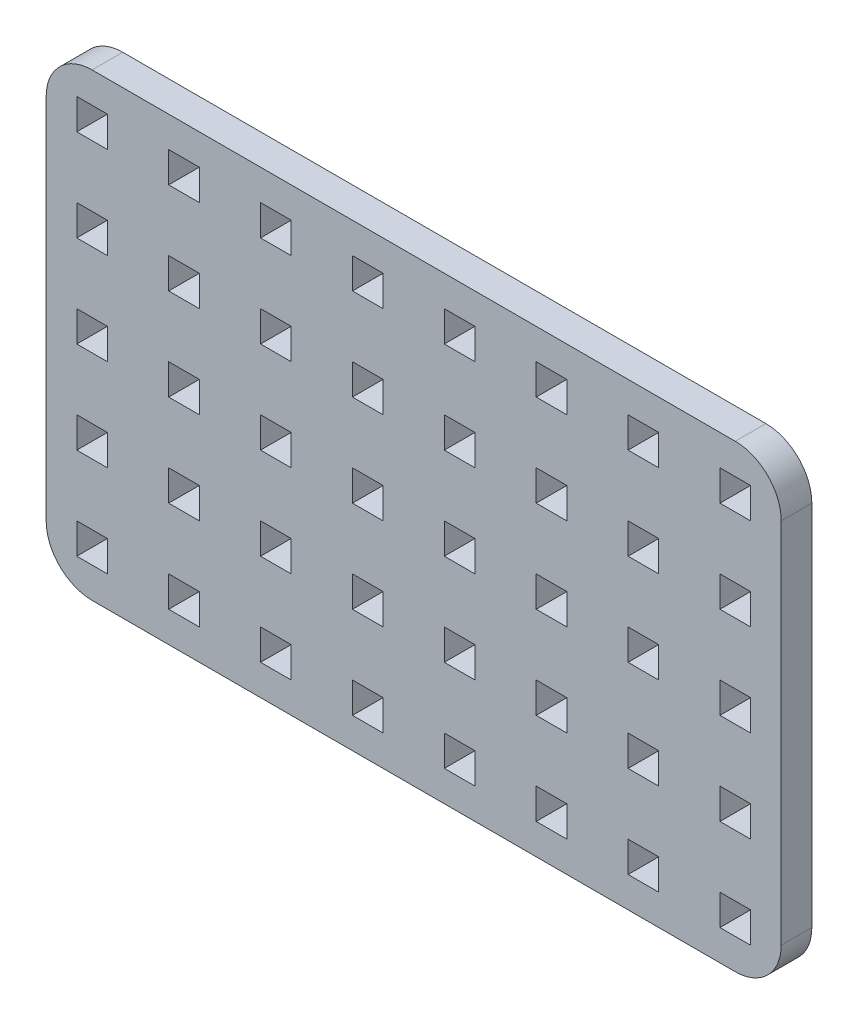
from build123d import *

# Parameters (mm, degrees)
MODEL_W                 = 3
MODEL_H                 = 3
SALIENTE_EXTRUIR1_DEPTH = 3


with BuildPart() as part:
    # Model → Saliente-Extruir1 (new body)
    with BuildSketch(Plane.XY):
        with BuildLine():
            Line((77.4201517, 259.741779533), (77.4201517, 295.741779533))
            ThreePointArc((77.4201517, 295.741779533), (76.102132215, 298.923760049), (72.9201517, 300.241779533))
            Line((72.9201517, 300.241779533), (9.9201517, 300.241779533))
            ThreePointArc((9.9201517, 300.241779533), (6.738171185, 298.923760049), (5.4201517, 295.741779533))
            Line((5.4201517, 295.741779533), (5.4201517, 259.741779533))
            ThreePointArc((5.4201517, 259.741779533), (6.738171185, 256.559799018), (9.9201517, 255.241779533))
            Line((9.9201517, 255.241779533), (72.9201517, 255.241779533))
            ThreePointArc((72.9201517, 255.241779533), (76.102132215, 256.559799018), (77.4201517, 259.741779533))
        make_face()
        with Locations((9.9201517, 295.741779533)):
            Rectangle(MODEL_W, MODEL_H, mode=Mode.SUBTRACT)
        with Locations((18.9201517, 295.741779533)):
            Rectangle(MODEL_W, MODEL_H, mode=Mode.SUBTRACT)
        with Locations((27.9201517, 295.741779533)):
            Rectangle(MODEL_W, MODEL_H, mode=Mode.SUBTRACT)
        with Locations((36.9201517, 295.741779533)):
            Rectangle(MODEL_W, MODEL_H, mode=Mode.SUBTRACT)
        with Locations((45.9201517, 295.741779533)):
            Rectangle(MODEL_W, MODEL_H, mode=Mode.SUBTRACT)
        with Locations((54.9201517, 295.741779533)):
            Rectangle(MODEL_W, MODEL_H, mode=Mode.SUBTRACT)
        with Locations((63.9201517, 295.741779533)):
            Rectangle(MODEL_W, MODEL_H, mode=Mode.SUBTRACT)
        with Locations((72.9201517, 295.741779533)):
            Rectangle(MODEL_W, MODEL_H, mode=Mode.SUBTRACT)
        with Locations((9.9201517, 259.741779533)):
            Rectangle(MODEL_W, MODEL_H, mode=Mode.SUBTRACT)
        with Locations((18.9201517, 259.741779533)):
            Rectangle(MODEL_W, MODEL_H, mode=Mode.SUBTRACT)
        with Locations((27.9201517, 259.741779533)):
            Rectangle(MODEL_W, MODEL_H, mode=Mode.SUBTRACT)
        with Locations((36.9201517, 259.741779533)):
            Rectangle(MODEL_W, MODEL_H, mode=Mode.SUBTRACT)
        with Locations((45.9201517, 259.741779533)):
            Rectangle(MODEL_W, MODEL_H, mode=Mode.SUBTRACT)
        with Locations((54.9201517, 259.741779533)):
            Rectangle(MODEL_W, MODEL_H, mode=Mode.SUBTRACT)
        with Locations((63.9201517, 259.741779533)):
            Rectangle(MODEL_W, MODEL_H, mode=Mode.SUBTRACT)
        with Locations((72.9201517, 259.741779533)):
            Rectangle(MODEL_W, MODEL_H, mode=Mode.SUBTRACT)
        with Locations((72.9201517, 286.741779533)):
            Rectangle(MODEL_W, MODEL_H, mode=Mode.SUBTRACT)
        with Locations((72.9201517, 268.741779533)):
            Rectangle(MODEL_W, MODEL_H, mode=Mode.SUBTRACT)
        with Locations((72.9201517, 277.741779533)):
            Rectangle(MODEL_W, MODEL_H, mode=Mode.SUBTRACT)
        with Locations((9.9201517, 286.741779533)):
            Rectangle(MODEL_W, MODEL_H, mode=Mode.SUBTRACT)
        with Locations((9.9201517, 268.741779533)):
            Rectangle(MODEL_W, MODEL_H, mode=Mode.SUBTRACT)
        with Locations((9.9201517, 277.741779533)):
            Rectangle(MODEL_W, MODEL_H, mode=Mode.SUBTRACT)
        with Locations((18.9201517, 268.741779533)):
            Rectangle(MODEL_W, MODEL_H, mode=Mode.SUBTRACT)
        with Locations((27.9201517, 268.741779533)):
            Rectangle(MODEL_W, MODEL_H, mode=Mode.SUBTRACT)
        with Locations((36.9201517, 268.741779533)):
            Rectangle(MODEL_W, MODEL_H, mode=Mode.SUBTRACT)
        with Locations((63.9201517, 268.741779533)):
            Rectangle(MODEL_W, MODEL_H, mode=Mode.SUBTRACT)
        with Locations((45.9201517, 268.741779533)):
            Rectangle(MODEL_W, MODEL_H, mode=Mode.SUBTRACT)
        with Locations((54.9201517, 268.741779533)):
            Rectangle(MODEL_W, MODEL_H, mode=Mode.SUBTRACT)
        with Locations((18.9201517, 277.741779533)):
            Rectangle(MODEL_W, MODEL_H, mode=Mode.SUBTRACT)
        with Locations((27.9201517, 277.741779533)):
            Rectangle(MODEL_W, MODEL_H, mode=Mode.SUBTRACT)
        with Locations((36.9201517, 277.741779533)):
            Rectangle(MODEL_W, MODEL_H, mode=Mode.SUBTRACT)
        with Locations((63.9201517, 277.741779533)):
            Rectangle(MODEL_W, MODEL_H, mode=Mode.SUBTRACT)
        with Locations((18.9201517, 286.741779533)):
            Rectangle(MODEL_W, MODEL_H, mode=Mode.SUBTRACT)
        with Locations((27.9201517, 286.741779533)):
            Rectangle(MODEL_W, MODEL_H, mode=Mode.SUBTRACT)
        with Locations((36.9201517, 286.741779533)):
            Rectangle(MODEL_W, MODEL_H, mode=Mode.SUBTRACT)
        with Locations((63.9201517, 286.741779533)):
            Rectangle(MODEL_W, MODEL_H, mode=Mode.SUBTRACT)
        with Locations((45.9201517, 277.741779533)):
            Rectangle(MODEL_W, MODEL_H, mode=Mode.SUBTRACT)
        with Locations((54.9201517, 277.741779533)):
            Rectangle(MODEL_W, MODEL_H, mode=Mode.SUBTRACT)
        with Locations((45.9201517, 286.741779533)):
            Rectangle(MODEL_W, MODEL_H, mode=Mode.SUBTRACT)
        with Locations((54.9201517, 286.741779533)):
            Rectangle(MODEL_W, MODEL_H, mode=Mode.SUBTRACT)
    extrude(amount=SALIENTE_EXTRUIR1_DEPTH)


solid = part.part
